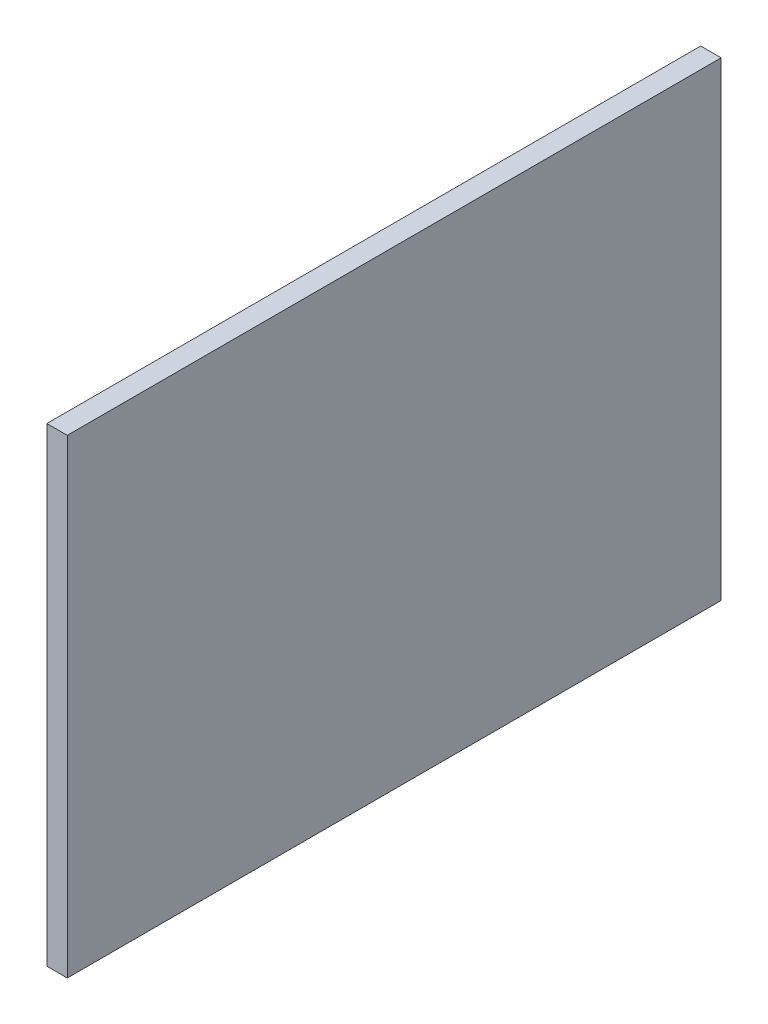
from build123d import *

# Parameters (mm, degrees)
SKETCH_1_W      = 160
SKETCH_1_H      = 115
EXTRUDE_1_DEPTH = 5


with BuildPart() as part:
    # Эскиз1 → Вытянуть1 (new body)
    with BuildSketch(Plane(origin=(0, 0, 0), x_dir=(0, 0, -1), z_dir=(1, 0, 0))):
        with Locations((-25.941693652, -3.350379538)):
            Rectangle(SKETCH_1_W, SKETCH_1_H)
    extrude(amount=EXTRUDE_1_DEPTH)


solid = part.part
